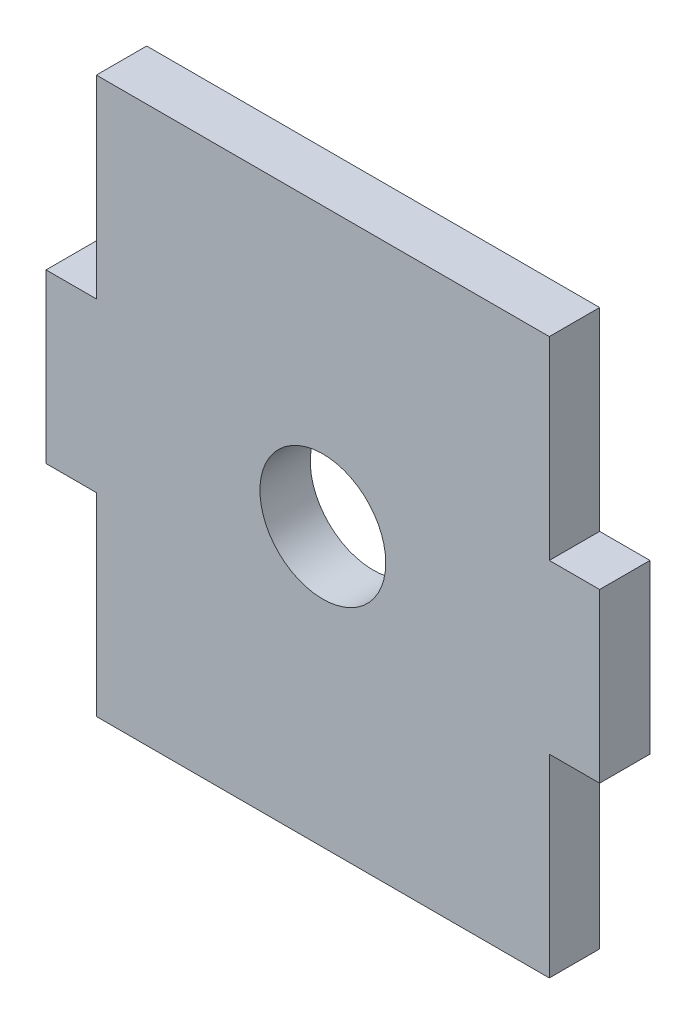
from build123d import *

# Parameters (mm, degrees)
CROQUIS1_R              = 3.75
SALIENTE_EXTRUIR1_DEPTH = 3


with BuildPart() as part:
    # Croquis1 → Saliente-Extruir1 (new body)
    with BuildSketch(Plane.XY):
        Polygon((-13.5, 5), (-13.5, 16.556349185), (13.5, 16.556349185), (13.5, 5), (16.5, 5), (16.5, -5), (13.5, -5), (13.5, -16.556349185), (-13.5, -16.556349185), (-13.5, -5), (-16.5, -5), (-16.5, 5), align=None)
        Circle(CROQUIS1_R, mode=Mode.SUBTRACT)
    extrude(amount=SALIENTE_EXTRUIR1_DEPTH)


solid = part.part
